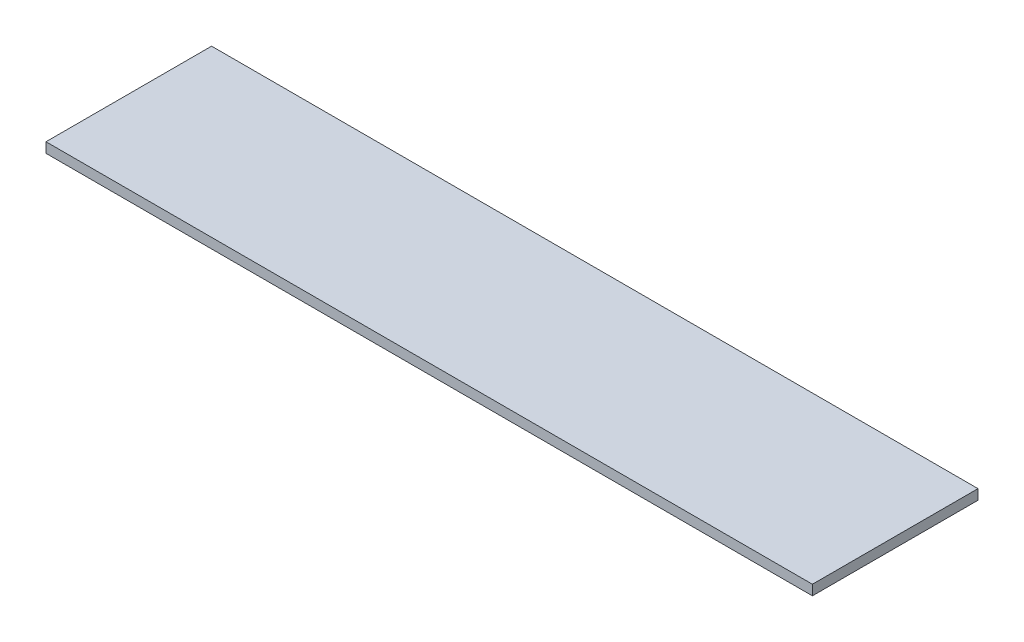
from build123d import *

# Parameters (mm, degrees)
SKETCH1_W      = 193.220387821
SKETCH1_H      = 41.746210879
EXTRUDE1_DEPTH = 2.54


with BuildPart() as part:
    # Sketch1 → Extrude1 (new body)
    with BuildSketch(Plane(origin=(0, 0, 0), x_dir=(1, 0, 0), z_dir=(0, 1, 0))):
        with Locations((-16.500921109, -22.691473327)):
            Rectangle(SKETCH1_W, SKETCH1_H)
    extrude(amount=EXTRUDE1_DEPTH)


solid = part.part
